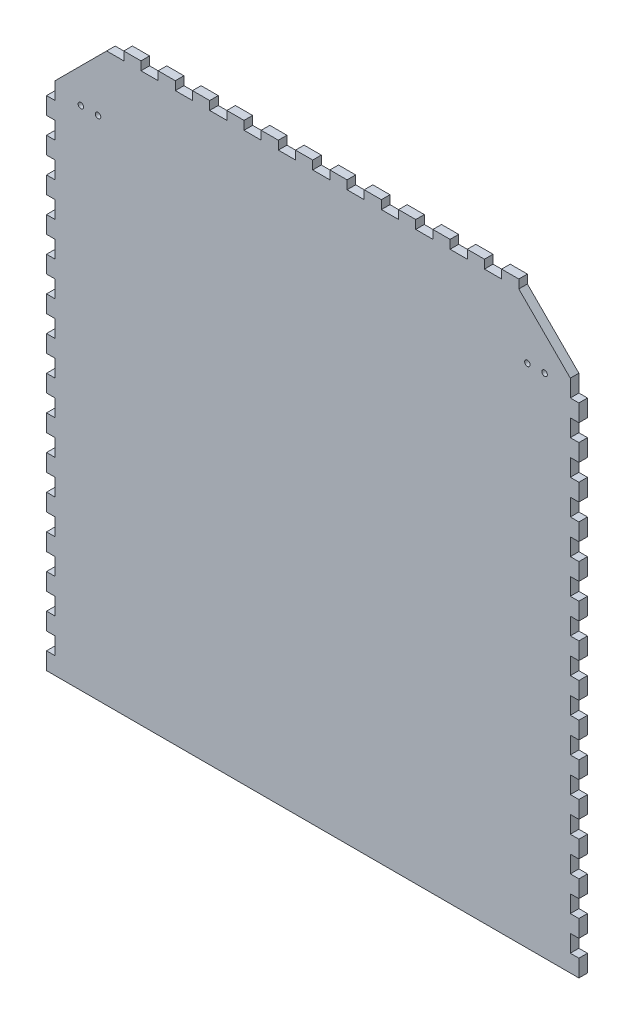
from build123d import *

# Parameters (mm, degrees)
SKIZZE1_R                       = 1.6
AUFSATZ_LINEAR_AUSTRAGEN1_DEPTH = 5


with BuildPart() as part:
    # Skizze1 → Aufsatz-Linear austragen1 (new body)
    with BuildSketch(Plane.XY):
        Polygon((5, 10), (5, 20), (0, 20), (0, 30), (5, 30), (5, 40), (0, 40), (0, 50), (5, 50), (5, 60), (0, 60), (0, 70), (5, 70), (5, 80), (0, 80), (0, 90), (5, 90), (5, 100), (0, 100), (0, 110), (5, 110), (5, 120), (0, 120), (0, 130), (5, 130), (5, 140), (0, 140), (0, 150), (5, 150), (5, 160), (0, 160), (0, 170), (5, 170), (5, 180), (0, 180), (0, 190), (5, 190), (5, 200), (0, 200), (0, 210), (5, 210), (5, 220), (35, 250), (45, 250), (45, 255), (55, 255), (55, 250), (65, 250), (65, 255), (75, 255), (75, 250), (85, 250), (85, 255), (95, 255), (95, 250), (105, 250), (105, 255), (115, 255), (115, 250), (125, 250), (125, 255), (135, 255), (135, 250), (145, 250), (145, 255), (155, 255), (155, 250), (165, 250), (165, 255), (175, 255), (175, 250), (185, 250), (185, 255), (195, 255), (195, 250), (205, 250), (205, 255), (215, 255), (215, 250), (225, 250), (225, 255), (235, 255), (235, 250), (245, 250), (245, 255), (255, 255), (255, 250), (265, 250), (265, 255), (275, 255), (275, 250), (305, 220), (305, 210), (310, 210), (310, 200), (305, 200), (305, 190), (310, 190), (310, 180), (305, 180), (305, 170), (310, 170), (310, 160), (305, 160), (305, 150), (310, 150), (310, 140), (305, 140), (305, 130), (310, 130), (310, 120), (305, 120), (305, 110), (310, 110), (310, 100), (305, 100), (305, 90), (310, 90), (310, 80), (305, 80), (305, 70), (310, 70), (310, 60), (305, 60), (305, 50), (310, 50), (310, 40), (305, 40), (305, 30), (310, 30), (310, 20), (305, 20), (305, 10), (310, 10), (310, 0), (305, 0), (305, -10), (310, -10), (310, -20), (305, -20), (305, -30), (310, -30), (310, -40), (305, -40), (305, -50), (310, -50), (310, -60), (305, -60), (305, -70), (310, -70), (310, -80), (305, -80), (5, -80), (0, -80), (0, -70), (5, -70), (5, -60), (0, -60), (0, -50), (5, -50), (5, -40), (0, -40), (0, -30), (5, -30), (5, -20), (0, -20), (0, -10), (5, -10), (5, 0), (0, 0), (0, 10), align=None)
        with Locations((20, 215)):
            Circle(SKIZZE1_R, mode=Mode.SUBTRACT)
        with Locations((30, 215)):
            Circle(SKIZZE1_R, mode=Mode.SUBTRACT)
        with Locations((290, 215)):
            Circle(SKIZZE1_R, mode=Mode.SUBTRACT)
        with Locations((280, 215)):
            Circle(SKIZZE1_R, mode=Mode.SUBTRACT)
    extrude(amount=AUFSATZ_LINEAR_AUSTRAGEN1_DEPTH)


solid = part.part
